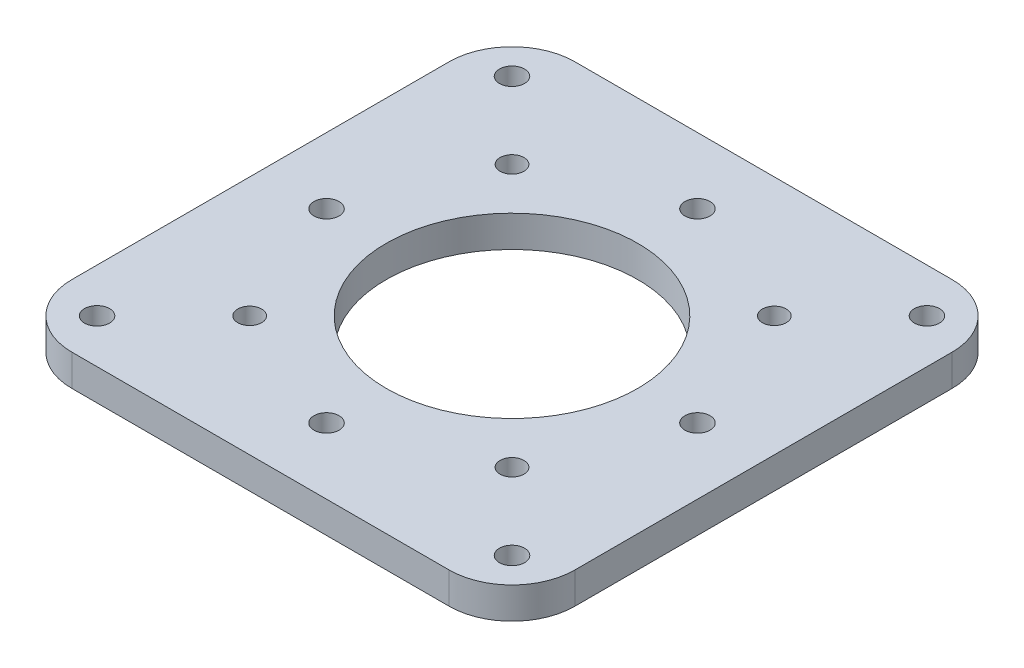
from build123d import *

# Parameters (mm, degrees)
SKETCH_1_W      = 80
SKETCH_1_H      = 80
SKETCH_1_R      = 1.9
SKETCH_1_R_2    = 2
SKETCH_1_R_3    = 20
EXTRUDE_1_DEPTH = 5
FILLET_5_R      = 10


with BuildPart() as part:
    # Эскиз1 → Бобышка-Вытянуть1 (new body)
    with BuildSketch(Plane(origin=(0, 0, 0), x_dir=(1, 0, 0), z_dir=(0, 1, 0))):
        Rectangle(SKETCH_1_W, SKETCH_1_H)
        with Locations(Location((20.859650045, 20.859650045, 0), (0, 0, 270))):
            Circle(SKETCH_1_R, mode=Mode.SUBTRACT)
        with Locations(Location((20.859650045, -20.859650045, 0), (0, 0, 270))):
            Circle(SKETCH_1_R, mode=Mode.SUBTRACT)
        with Locations(Location((-20.859650045, -20.859650045, 0), (0, 0, 270))):
            Circle(SKETCH_1_R, mode=Mode.SUBTRACT)
        with Locations(Location((-20.859650045, 20.859650045, 0), (0, 0, 270))):
            Circle(SKETCH_1_R, mode=Mode.SUBTRACT)
        with Locations(Location((-33, 33, 0), (0, 0, 270))):
            Circle(SKETCH_1_R_2, mode=Mode.SUBTRACT)
        with Locations(Location((33, 33, 0), (0, 0, 270))):
            Circle(SKETCH_1_R_2, mode=Mode.SUBTRACT)
        with Locations(Location((33, -33, 0), (0, 0, 270))):
            Circle(SKETCH_1_R_2, mode=Mode.SUBTRACT)
        with Locations(Location((-33, -33, 0), (0, 0, 270))):
            Circle(SKETCH_1_R_2, mode=Mode.SUBTRACT)
        with Locations(Location((0, 0, 0), (0, 0, 270))):
            Circle(SKETCH_1_R_3, mode=Mode.SUBTRACT)
        with Locations(Location((0, 29.5, 0), (0, 0, 270))):
            Circle(SKETCH_1_R_2, mode=Mode.SUBTRACT)
        with Locations(Location((29.5, 0, 0), (0, 0, 270))):
            Circle(SKETCH_1_R_2, mode=Mode.SUBTRACT)
        with Locations(Location((0, -29.5, 0), (0, 0, 270))):
            Circle(SKETCH_1_R_2, mode=Mode.SUBTRACT)
        with Locations(Location((-29.5, 0, 0), (0, 0, 270))):
            Circle(SKETCH_1_R_2, mode=Mode.SUBTRACT)
    extrude(amount=EXTRUDE_1_DEPTH)

    # Скругление5
    fillet_5_edges = [part.edges().sort_by_distance(p)[0] for p in [
        (40, 2.5, 40),
        (-40, 2.5, 40),
        (-40, 2.5, -40),
        (40, 2.5, -40),
    ]]
    fillet(fillet_5_edges, radius=FILLET_5_R)


solid = part.part
